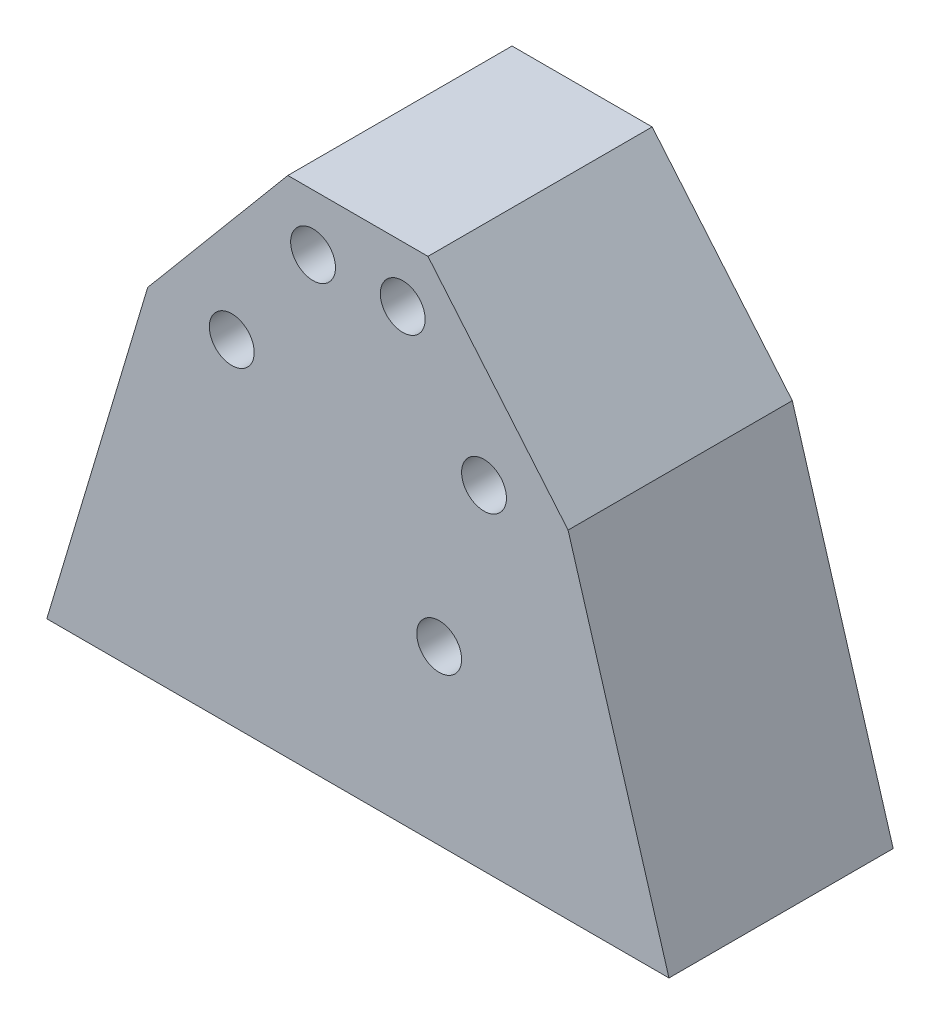
from build123d import *

# Parameters (mm, degrees)
SKETCH4_R           = 4
BOSS_EXTRUDE1_DEPTH = 40
SKETCH5_R           = 1.75
CUT_EXTRUDE1_DEPTH  = 15
SKETCH6_W           = 59.399220689
SKETCH6_H           = 23.559499922
CUT_EXTRUDE3_DEPTH  = 30
BOSS_EXTRUDE2_DEPTH = 40


with BuildPart() as part:
    # Sketch4 → Boss-Extrude1 (new body)
    # profile 1 of 2: a face of its own
    with BuildSketch(Plane.XY):
        Polygon((0, -45), (37.5, -45), (37.5, 15.206160185), (12.5, 45), (0, 45), align=None)
        with Locations((14.5, -14.279076444)):
            Circle(SKETCH4_R, mode=Mode.SUBTRACT)
        with Locations((22.5, 14.634588146)):
            Circle(SKETCH4_R, mode=Mode.SUBTRACT)
        with Locations((8, 35)):
            Circle(SKETCH4_R, mode=Mode.SUBTRACT)
    # profile 2 of 2: a face of its own
    with BuildSketch(Plane.XY):
        Polygon((-37.5, -45), (0, -45), (0, 45), (-12.5, 45), (-37.5, 15.206160185), align=None)
        with Locations((-22.5, 14.634588146)):
            Circle(SKETCH4_R, mode=Mode.SUBTRACT)
        with Locations((-8, 35)):
            Circle(SKETCH4_R, mode=Mode.SUBTRACT)
    extrude(amount=BOSS_EXTRUDE1_DEPTH)

    # Sketch5 → Cut-Extrude1 (cut)
    with BuildSketch(Plane.XZ.offset(45)):
        with Locations((-30, 7.15)):
            Circle(SKETCH5_R)
        with Locations(Location((30, 7.15, 0), (0, 0, 180))):
            Circle(SKETCH5_R)
        with Locations((30, 32.85)):
            Circle(SKETCH5_R)
        with Locations(Location((-30, 32.85, 0), (0, 0, 180))):
            Circle(SKETCH5_R)
    extrude(amount=-CUT_EXTRUDE1_DEPTH, mode=Mode.SUBTRACT)

    # Sketch6 → Cut-Extrude3 (cut)
    with BuildSketch(Plane(origin=(0, 0, 0), x_dir=(-1, 0, 0), z_dir=(0, 0, -1))):
        with Locations((-4.650193569, -14.217324683)):
            Rectangle(SKETCH6_W, SKETCH6_H)
    extrude(amount=-CUT_EXTRUDE3_DEPTH, mode=Mode.SUBTRACT)

    # Sketch7 → Boss-Extrude2 (add)
    with BuildSketch(Plane.XY.offset(40)):
        Polygon((-37.5, 15.206160185), (-55.5, -45), (-37.5, -45), align=None)
        Polygon((37.5, -45), (37.5, 15.206160185), (55.5, -45), align=None)
    extrude(amount=-BOSS_EXTRUDE2_DEPTH)


solid = part.part
